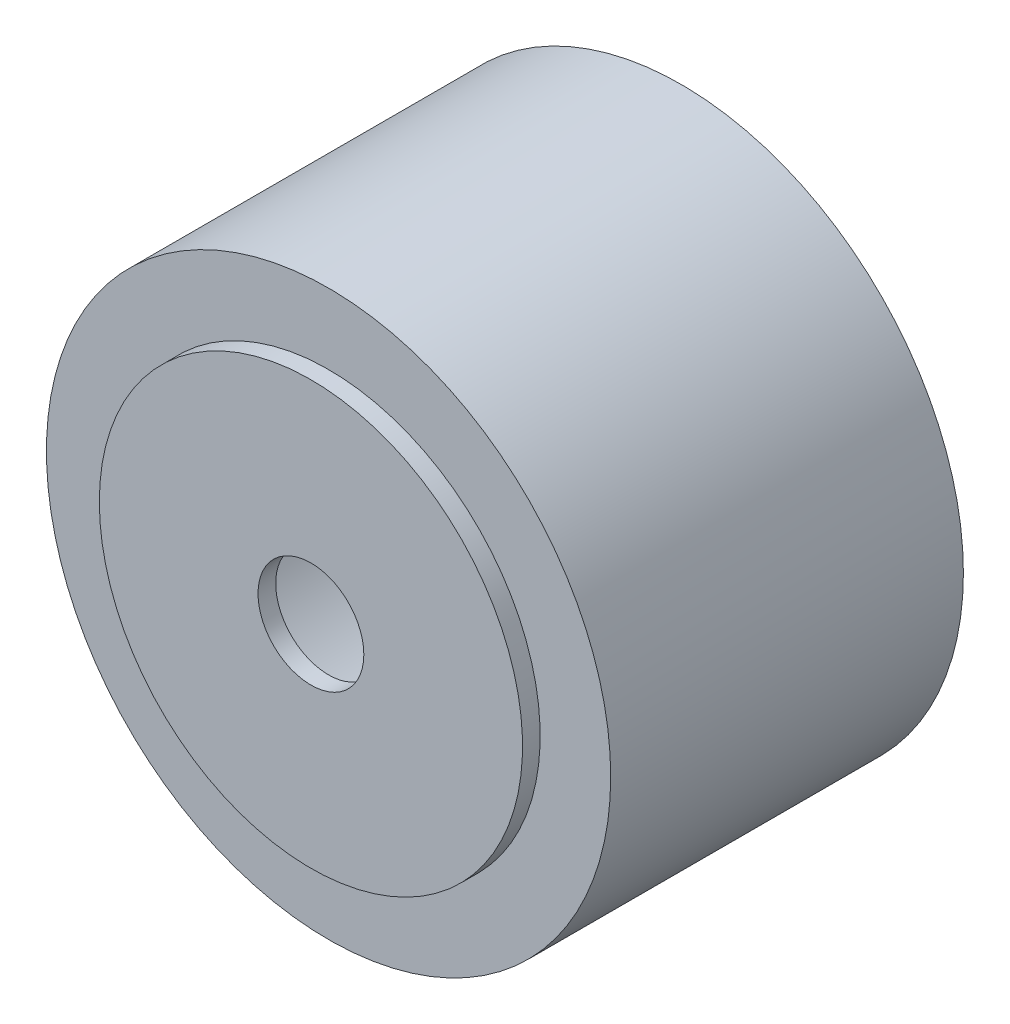
from build123d import *

# Parameters (mm, degrees)
ESBO_O1_R                = 16
ESBO_O1_R_2              = 12
RESSALTO_EXTRUS_O1_DEPTH = 20
ESBO_O2_R                = 12
ESBO_O2_R_2              = 10
RESSALTO_EXTRUS_O2_DEPTH = 1
ESBO_O3_R                = 12
ESBO_O3_R_2              = 10
RESSALTO_EXTRUS_O3_DEPTH = 21
ESBO_O4_R                = 10
ESBO_O4_R_2              = 3
RESSALTO_EXTRUS_O4_DEPTH = 1


with BuildPart() as part:
    # Esboço1 → Ressalto-extrusão1 (new body)
    with BuildSketch(Plane.XY):
        Circle(ESBO_O1_R)
        Circle(ESBO_O1_R_2, mode=Mode.SUBTRACT)
    extrude(amount=RESSALTO_EXTRUS_O1_DEPTH)



with BuildPart() as body_2:
    # Esboço2 → Ressalto-extrusão2 (new body)
    with BuildSketch(Plane(origin=(0, 0, 0), x_dir=(-1, 0, 0), z_dir=(0, 0, -1))):
        with Locations(Location((0, 0, 0), (0, 0, 180))):
            Circle(ESBO_O2_R)
        Circle(ESBO_O2_R_2, mode=Mode.SUBTRACT)
    extrude(amount=RESSALTO_EXTRUS_O2_DEPTH)


with BuildPart() as part_1:
    add(part.part)

    add(body_2.part)  # Ressalto-extrusão3 merges body 2
    # Esboço3 → Ressalto-extrusão3 (add)
    with BuildSketch(Plane.XY):
        with Locations(Location((0, 0, 0), (0, 0, 180))):
            Circle(ESBO_O3_R)
        with Locations(Location((0, 0, 0), (0, 0, 180))):
            Circle(ESBO_O3_R_2, mode=Mode.SUBTRACT)
    extrude(amount=RESSALTO_EXTRUS_O3_DEPTH)

    # Esboço4 → Ressalto-extrusão4 (add)
    with BuildSketch(Plane.XY.offset(21)):
        with Locations(Location((0, 0, 0), (0, 0, 180))):
            Circle(ESBO_O4_R)
        Circle(ESBO_O4_R_2, mode=Mode.SUBTRACT)
    extrude(amount=-RESSALTO_EXTRUS_O4_DEPTH)


solid = part_1.part
